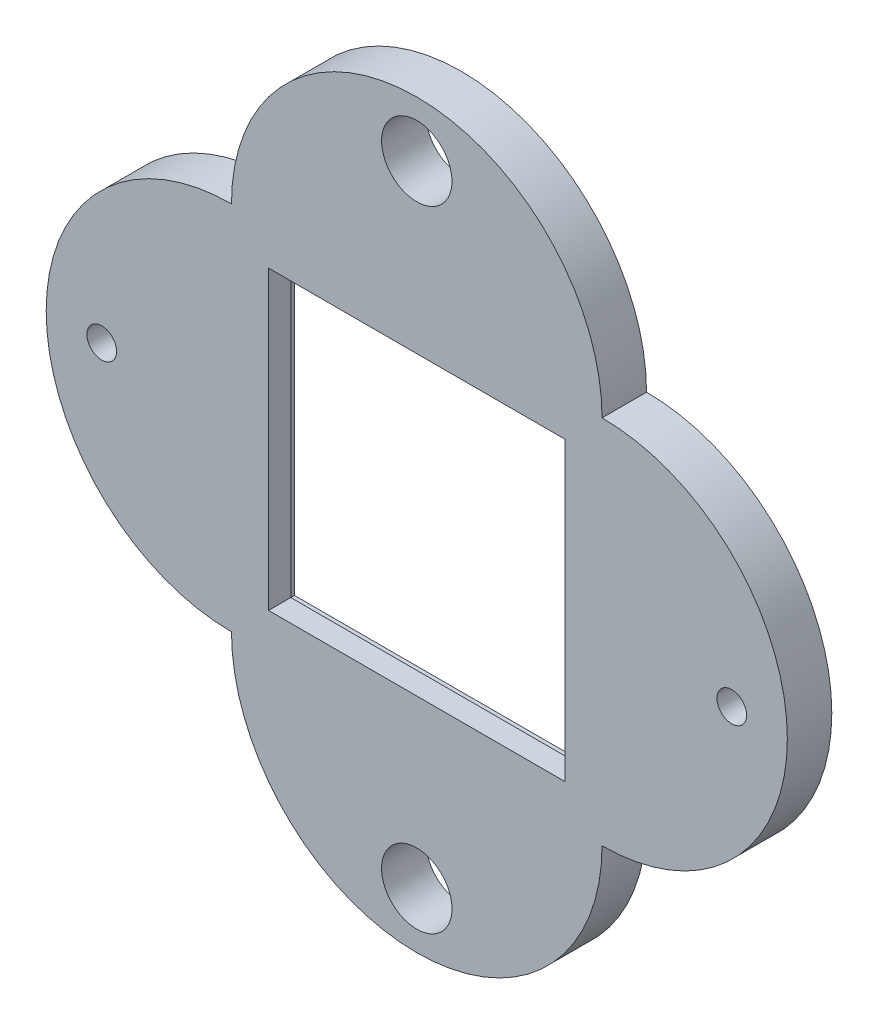
from build123d import *

# Parameters (mm, degrees)
IZIM1_R                     = 9.5
IZIM1_R_2                   = 4
IZIM1_W                     = 90
IZIM1_H                     = 90
Y_KSEKLIK_EKSTR_ZYON1_DEPTH = 12
IZIM2_W                     = 90
IZIM2_H                     = 90
IZIM2_W_2                   = 80
IZIM2_H_2                   = 80
Y_KSEKLIK_EKSTR_ZYON2_DEPTH = 6


with BuildPart() as part:
    # Çizim1 → Yükseklik-Ekstrüzyon1 (new body)
    with BuildSketch(Plane.XY):
        with BuildLine():
            ThreePointArc((45.945945946, 48.048048048), (-4.054054054, 98.048048048), (-54.054054054, 48.048048048))
            ThreePointArc((-54.054054054, 48.048048048), (-104.054054054, -1.951951952), (-54.054054054, -51.951951952))
            ThreePointArc((-54.054054054, -51.951951952), (-4.054054054, -101.951951952), (45.945945946, -51.951951952))
            ThreePointArc((45.945945946, -51.951951952), (95.945945946, -1.951951952), (45.945945946, 48.048048048))
        make_face()
        with Locations((-4.054054054, -86.951951952)):
            Circle(IZIM1_R, mode=Mode.SUBTRACT)
        with Locations((-89.054054054, -1.951951952)):
            Circle(IZIM1_R_2, mode=Mode.SUBTRACT)
        with Locations((-4.054054054, 83.048048048)):
            Circle(IZIM1_R, mode=Mode.SUBTRACT)
        with Locations((80.945945946, -1.951951952)):
            Circle(IZIM1_R_2, mode=Mode.SUBTRACT)
        with Locations((-4.054054054, -1.951951952)):
            Rectangle(IZIM1_W, IZIM1_H, mode=Mode.SUBTRACT)
    extrude(amount=Y_KSEKLIK_EKSTR_ZYON1_DEPTH)

    # Çizim2 → Yükseklik-Ekstrüzyon2 (add)
    with BuildSketch(Plane.XY.offset(12)):
        with Locations((-4.054054054, -1.951951952)):
            Rectangle(IZIM2_W, IZIM2_H)
        with Locations((-4.054054054, -1.951951952)):
            Rectangle(IZIM2_W_2, IZIM2_H_2, mode=Mode.SUBTRACT)
    extrude(amount=-Y_KSEKLIK_EKSTR_ZYON2_DEPTH)


solid = part.part
